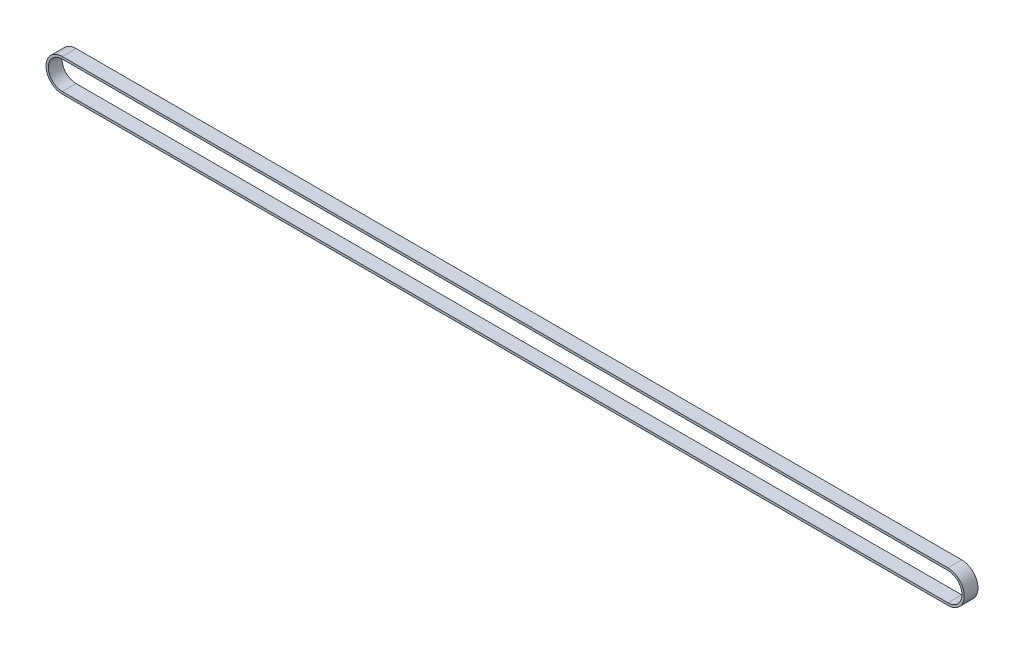
from build123d import *

# Parameters (mm, degrees)
EXTRUDE_THIN1_DEPTH = 6


with BuildPart() as part:
    # Sketch2 → Extrude-Thin1 (new body)
    with BuildSketch(Plane.XY):
        with BuildLine():
            Line((192.875, -6.1), (0, -6.1))
            ThreePointArc((0, -6.1), (-6.1, 0), (0, 6.1))
            Line((0, 6.1), (192.875, 6.1))
            Line((192.875, 6.1), (192.875, 7.1))
            Line((192.875, 7.1), (0, 7.1))
            ThreePointArc((0, 7.1), (-7.1, 0), (0, -7.1))
            Line((0, -7.1), (192.875, -7.1))
            Line((192.875, -7.1), (192.875, -6.1))
        make_face()
    extrude_thin1 = extrude(amount=EXTRUDE_THIN1_DEPTH)

    # Mirror1: Extrude-Thin1 across plane
    add(extrude_thin1.mirror(Plane(origin=(192.875, 7.1, 6), x_dir=(0, 0, 1), z_dir=(1, 0, 0))))


solid = part.part
